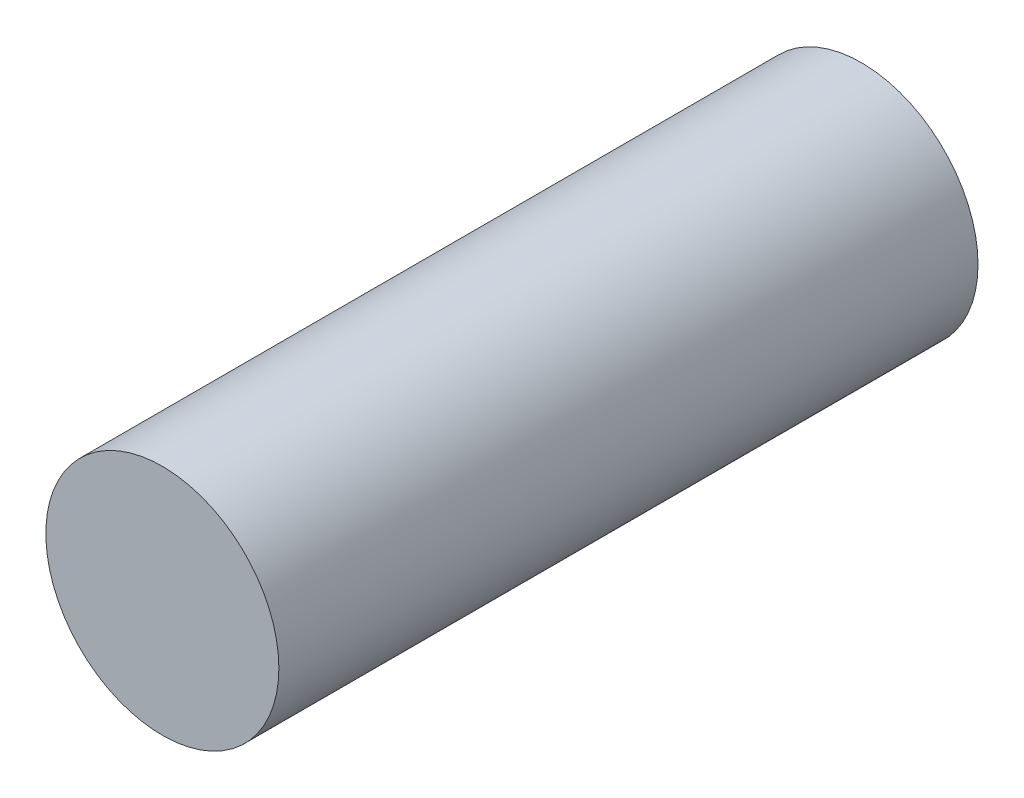
from build123d import *

# Parameters (mm, degrees)
SKETCH_1_R          = 25
EXTRUDE_1_DEPTH     = 150
SKETCH_2_W          = 3.051064085
SKETCH_2_H          = 16.585271438
CUT_EXTRUDE_1_DEPTH = 6


with BuildPart() as part:
    # 草图1 → 凸台-拉伸1 (new body)
    with BuildSketch(Plane.XY):
        Circle(SKETCH_1_R)
    extrude(amount=EXTRUDE_1_DEPTH)

    # 草图2 → 切除-拉伸1 (cut)
    with BuildSketch(Plane(origin=(0, 0, 0), x_dir=(-1, 0, 0), z_dir=(0, 0, -1))):
        with Locations((5.319804046, -0.899672743)):
            Rectangle(SKETCH_2_W, SKETCH_2_H)
    extrude(amount=-CUT_EXTRUDE_1_DEPTH, mode=Mode.SUBTRACT)


solid = part.part
